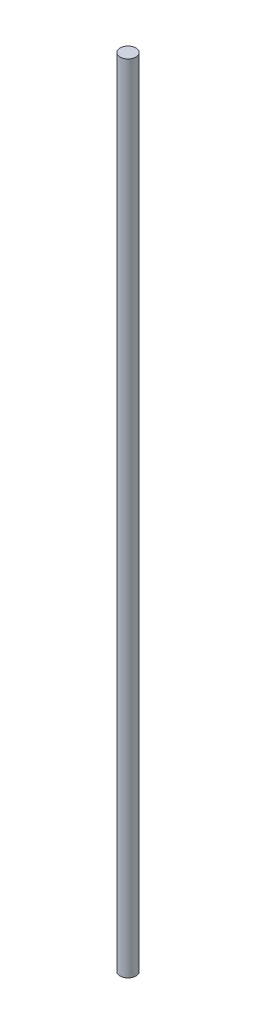
from build123d import *

# Parameters (mm, degrees)
SKETCH1_R           = 12
BOSS_EXTRUDE1_DEPTH = 1200


with BuildPart() as part:
    # Sketch1 → Boss-Extrude1 (new body)
    with BuildSketch(Plane(origin=(0, 0, 0), x_dir=(1, 0, 0), z_dir=(0, 1, 0))):
        with Locations(Location((0, 0, 0), (0, 0, 270))):
            Circle(SKETCH1_R)
    extrude(amount=BOSS_EXTRUDE1_DEPTH)


solid = part.part
